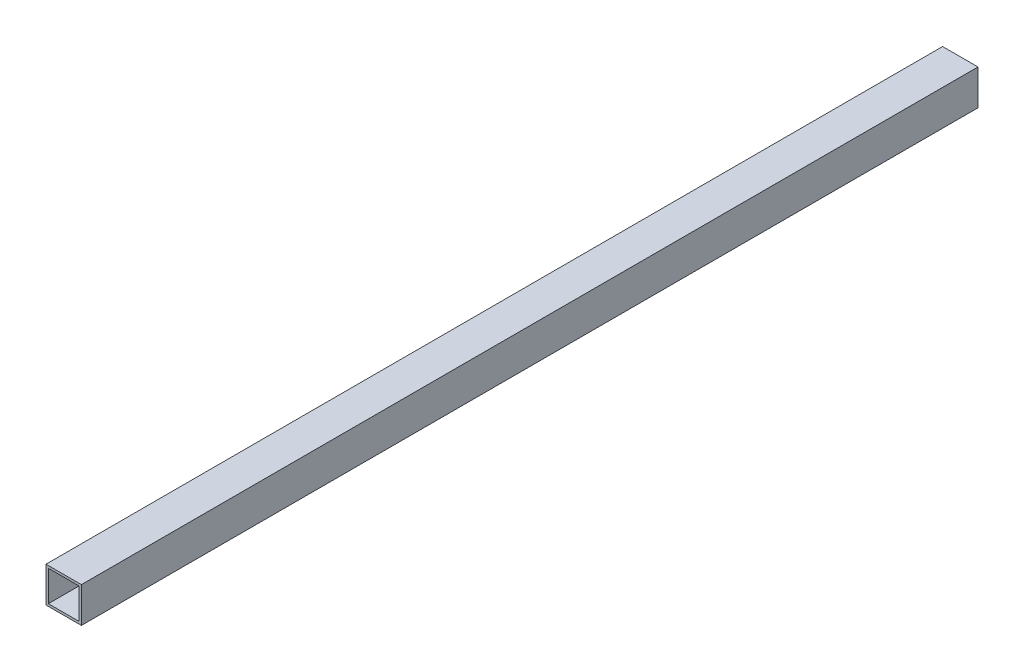
from build123d import *

# Parameters (mm, degrees)
SKETCH1_W           = 38.1
SKETCH1_H           = 38.1
SKETCH1_W_2         = 33.02
SKETCH1_H_2         = 33.02
BOSS_EXTRUDE1_DEPTH = 482.6


with BuildPart() as part:
    # Sketch1 → Boss-Extrude1 (new, symmetric)
    with BuildSketch(Plane.XY):
        Rectangle(SKETCH1_W, SKETCH1_H)
        Rectangle(SKETCH1_W_2, SKETCH1_H_2, mode=Mode.SUBTRACT)
    extrude(amount=BOSS_EXTRUDE1_DEPTH, both=True)


solid = part.part
